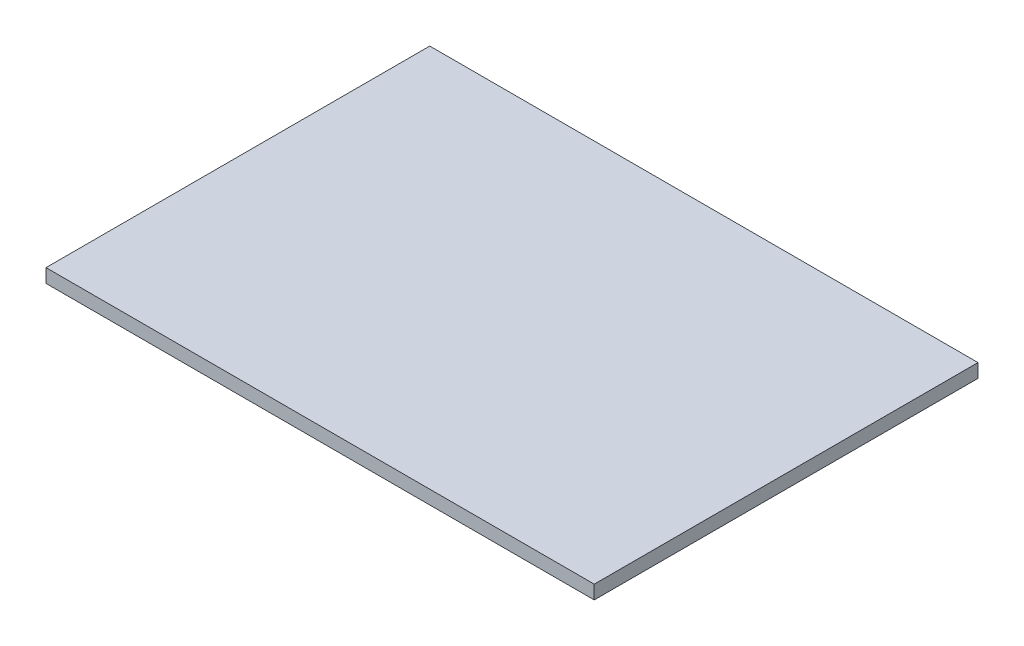
from build123d import *

# Parameters (mm, degrees)
CROQUIS1_W              = 200
CROQUIS1_H              = 140
SALIENTE_EXTRUIR1_DEPTH = 5


with BuildPart() as part:
    # Croquis1 → Saliente-Extruir1 (new body)
    with BuildSketch(Plane(origin=(0, 0, 0), x_dir=(1, 0, 0), z_dir=(0, 1, 0))):
        with Locations((100, 70)):
            Rectangle(CROQUIS1_W, CROQUIS1_H)
    extrude(amount=SALIENTE_EXTRUIR1_DEPTH)


solid = part.part
